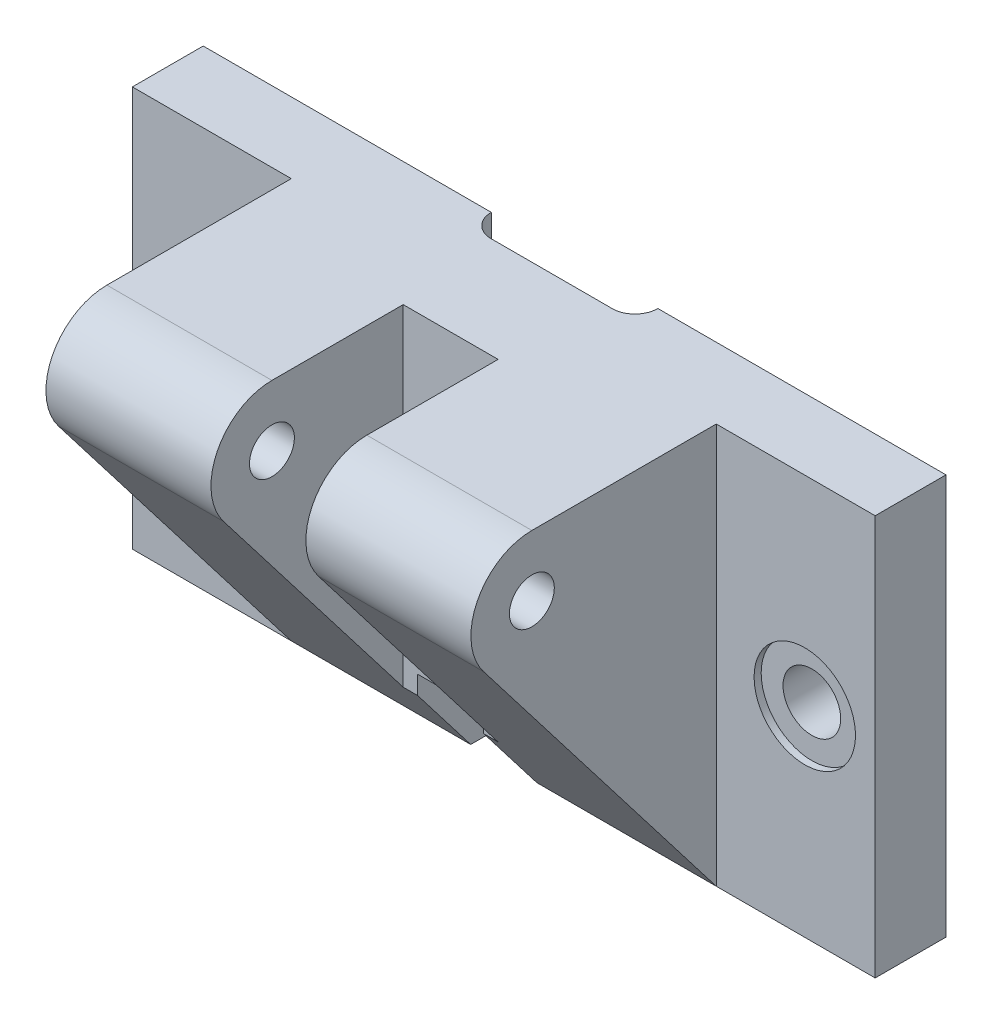
from build123d import *

# Parameters (mm, degrees)
SZKIC1_W                    = 104.872117299
SZKIC1_H                    = 113.043153049
SZKIC1_R                    = 8.139229877
DODANIE_WYCI_GNI_CIE1_DEPTH = 20
SZKIC2_R                    = 14.315912416
WYTNIJ_WYCI_GNI_CIE1_DEPTH  = 2
WYTNIJ_WYCI_GNI_CIE2_DEPTH  = 140
SZKIC9_R                    = 6.34096602
DODANIE_WYCI_GNI_CIE2_DEPTH = 60
SZKIC12_W                   = 26.801545634
SZKIC12_H                   = 113.043153049
WYTNIJ_WYCI_GNI_CIE8_DEPTH  = 99
SZKIC13_W                   = 18.676589494
SZKIC13_H                   = 43.251049354
WYTNIJ_WYCI_GNI_CIE9_DEPTH  = 85


with BuildPart() as part:
    # Szkic1 → Dodanie-wyciągnięcie1 (new body)
    with BuildSketch(Plane.XY):
        with Locations((-52.43605865, 6.459608746)):
            Rectangle(SZKIC1_W, SZKIC1_H)
        with Locations((-84.996398081, 6.459608746)):
            Circle(SZKIC1_R, mode=Mode.SUBTRACT)
    dodanie_wyci_gni_cie1 = extrude(amount=DODANIE_WYCI_GNI_CIE1_DEPTH)

    # Szkic2 → Wytnij-wyciągnięcie1 (cut)
    with BuildSketch(Plane.XY.offset(20)):
        with Locations((-84.996398081, 6.459608746)):
            Circle(SZKIC2_R)
    wytnij_wyci_gni_cie1 = extrude(amount=-WYTNIJ_WYCI_GNI_CIE1_DEPTH, mode=Mode.SUBTRACT)

    # Lustro2: Dodanie-wyciągnięcie1, Wytnij-wyciągnięcie1 across plane
    add(dodanie_wyci_gni_cie1.mirror(Plane(origin=(0, 62.98118527, 20), x_dir=(0, 0, 1), z_dir=(-1, 0, 0))))
    add(wytnij_wyci_gni_cie1.mirror(Plane(origin=(0, 62.98118527, 20), x_dir=(0, 0, 1), z_dir=(-1, 0, 0))), mode=Mode.SUBTRACT)

    # Szkic6 → Wytnij-wyciągnięcie2 (cut)
    with BuildSketch(Plane(origin=(0, 62.98118527, 0), x_dir=(1, 0, 0), z_dir=(0, 1, 0))):
        with BuildLine():
            Line((-23.533046442, 0), (23.533046442, 0))
            ThreePointArc((23.533046442, 0), (21.432956346, -4.78054627), (16.491575681, -6.467780152))
            Line((16.491575681, -6.467780152), (-16.491575681, -6.467780152))
            ThreePointArc((-16.491575681, -6.467780152), (-21.432956346, -4.78054627), (-23.533046442, 0))
        make_face()
    extrude(amount=-WYTNIJ_WYCI_GNI_CIE2_DEPTH, mode=Mode.SUBTRACT)

    # Szkic9 → Dodanie-wyciągnięcie2 (add)
    with BuildSketch(Plane(origin=(0, 0, 0), x_dir=(0, 0, -1), z_dir=(1, 0, 0))):
        with BuildLine():
            Line((-20, 62.98118527), (-72.068850924, 62.98118527))
            ThreePointArc((-72.068850924, 62.98118527), (-87.508244639, 53.371610982), (-85.703573327, 35.27570101))
            Line((-85.703573327, 35.27570101), (-20, -50.061967779))
            Line((-20, -50.061967779), (-20, 62.98118527))
        make_face()
        with Locations((-72.068850924, 45.773409652)):
            Circle(SZKIC9_R, mode=Mode.SUBTRACT)
    dodanie_wyci_gni_cie2 = extrude(amount=DODANIE_WYCI_GNI_CIE2_DEPTH)

    # Lustro3: Dodanie-wyciągnięcie2 across plane
    add(dodanie_wyci_gni_cie2.mirror(Plane(origin=(0, 45.773409652, 72.068850924), x_dir=(0, 0, 1), z_dir=(1, 0, 0))))

    # Szkic12 → Wytnij-wyciągnięcie8 (cut)
    with BuildSketch(Plane.XY.offset(35)):
        with Locations((0, 6.459608746)):
            Rectangle(SZKIC12_W, SZKIC12_H)
    extrude(amount=WYTNIJ_WYCI_GNI_CIE8_DEPTH, mode=Mode.SUBTRACT)

    # Szkic13 → Wytnij-wyciągnięcie9 (cut)
    with BuildSketch(Plane.XY.offset(35)):
        with Locations((0, -46.989841451)):
            Rectangle(SZKIC13_W, SZKIC13_H)
    extrude(amount=-WYTNIJ_WYCI_GNI_CIE9_DEPTH, mode=Mode.SUBTRACT)


solid = part.part
